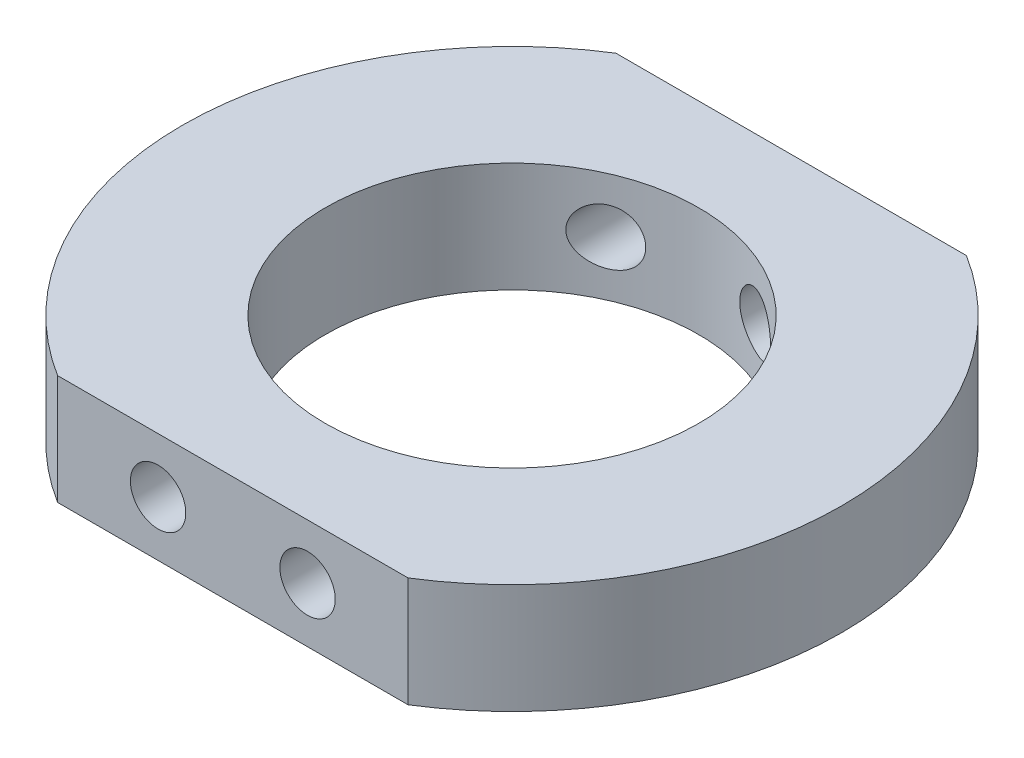
from build123d import *

# Parameters (mm, degrees)
SKETCH1_R            = 38.1
EXTRUDE2_DEPTH       = 12.7
SKETCH5_R            = 21.59
EXTRUDE3_DEPTH       = 56.358016583
EXTRUDE4_DEPTH       = 56.358016583
EXTRUDE4_DEPTH_BACK  = 56.358016583
EXTRUDE5_DEPTH       = 56.358016583
EXTRUDE5_DEPTH_BACK  = 56.358016583
M6_CLEARANCE_HOLE1_D = 6.4


with BuildPart() as part:
    # Sketch1 → Extrude2 (new body)
    with BuildSketch(Plane(origin=(0, 0, 0), x_dir=(1, 0, 0), z_dir=(0, 1, 0))):
        with Locations(Location((0, 0, 0), (0, 0, 270))):
            Circle(SKETCH1_R)
    extrude(amount=-EXTRUDE2_DEPTH)

    # Sketch5 → Extrude3 (cut, through all)
    with BuildSketch(Plane(origin=(0, 0, 0), x_dir=(1, 0, 0), z_dir=(0, 1, 0))):
        with Locations(Location((0, 0, 0), (0, 0, 270))):
            Circle(SKETCH5_R)
    extrude(amount=-EXTRUDE3_DEPTH, mode=Mode.SUBTRACT)

    # Sketch6 → Extrude4 (cut, two sides: drawn at the far end of the back side and taken through both)
    with BuildSketch(Plane(origin=(0, 0, 0), x_dir=(1, 0, 0), z_dir=(0, 1, 0)).offset(-EXTRUDE4_DEPTH_BACK)):
        Polygon((-213.093459479, 32.268567529), (-20.257086404, 32.268567529), (20.257086404, 32.268567529), (213.093459479, 32.268567529), (213.093459479, 417.941313679), (-213.093459479, 417.941313679), align=None)
    extrude(amount=EXTRUDE4_DEPTH + EXTRUDE4_DEPTH_BACK, mode=Mode.SUBTRACT)

    # Sketch7 → Extrude5 (cut, two sides: drawn at the far end of the back side and taken through both)
    with BuildSketch(Plane(origin=(0, 0, 0), x_dir=(1, 0, 0), z_dir=(0, 1, 0)).offset(-EXTRUDE5_DEPTH_BACK)):
        Polygon((-204.275376653, -32.268567529), (-20.257086404, -32.268567529), (20.257086404, -32.268567529), (204.275376653, -32.268567529), (204.275376653, -400.305148026), (-204.275376653, -400.305148026), align=None)
    extrude(amount=EXTRUDE5_DEPTH + EXTRUDE5_DEPTH_BACK, mode=Mode.SUBTRACT)

    # M6 Clearance Hole1 (through all)
    with Locations(Plane(origin=(8.636, -6.35, -32.268567529), x_dir=(-1, 0, 0), z_dir=(0, 0, -1))):
        with Locations((0, 0), (17.272, 0)):
            Hole(M6_CLEARANCE_HOLE1_D / 2)


solid = part.part
